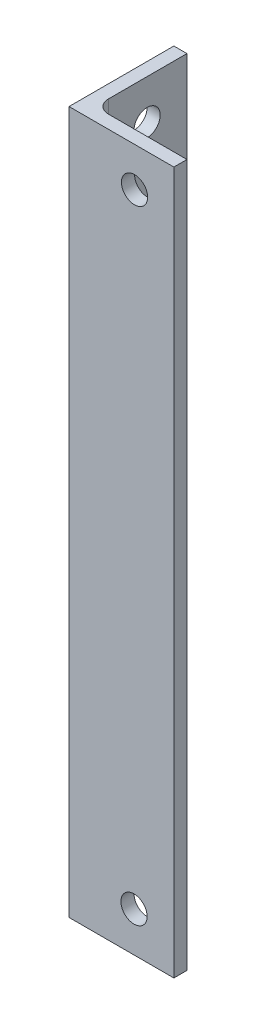
from build123d import *

# Parameters (mm, degrees)
BOSS_EXTRUDE1_DEPTH = 170.18
FILLET1_R           = 3.175
SKETCH2_R           = 3.175
CUT_EXTRUDE1_DEPTH  = 174.929734088
SKETCH3_R           = 3.175
CUT_EXTRUDE2_DEPTH  = 174.929734088
SKETCH4_R           = 3.175
CUT_EXTRUDE3_DEPTH  = 174.494504308
SKETCH5_R           = 3.175
CUT_EXTRUDE4_DEPTH  = 174.494504308


with BuildPart() as part:
    # Sketch1 → Boss-Extrude1 (new body)
    with BuildSketch(Plane(origin=(0, 0, 0), x_dir=(1, 0, 0), z_dir=(0, 1, 0))):
        Polygon((0, 0), (3.175, 0), (3.175, -22.225), (25.4, -22.225), (25.4, -25.4), (0, -25.4), align=None)
    extrude(amount=BOSS_EXTRUDE1_DEPTH)

    # Fillet1
    fillet1_edges = [part.edges().sort_by_distance(p)[0] for p in [
        (3.175, 85.09, 22.225),
    ]]
    fillet(fillet1_edges, radius=FILLET1_R)

    # Sketch2 → Cut-Extrude1 (cut, through all)
    with BuildSketch(Plane.ZY):
        with Locations((9.652, 160.528)):
            Circle(SKETCH2_R)
    extrude(amount=-CUT_EXTRUDE1_DEPTH, mode=Mode.SUBTRACT)

    # Sketch3 → Cut-Extrude2 (cut, through all)
    with BuildSketch(Plane.ZY):
        with Locations((9.652, 9.652)):
            Circle(SKETCH3_R)
    extrude(amount=-CUT_EXTRUDE2_DEPTH, mode=Mode.SUBTRACT)

    # Sketch4 → Cut-Extrude3 (cut, through all)
    with BuildSketch(Plane(origin=(0, 0, 22.225), x_dir=(-1, 0, 0), z_dir=(0, 0, -1))):
        with Locations((-15.748, 9.652)):
            Circle(SKETCH4_R)
    extrude(amount=-CUT_EXTRUDE3_DEPTH, mode=Mode.SUBTRACT)

    # Sketch5 → Cut-Extrude4 (cut, through all)
    with BuildSketch(Plane(origin=(0, 0, 22.225), x_dir=(-1, 0, 0), z_dir=(0, 0, -1))):
        with Locations((-15.875, 160.655)):
            Circle(SKETCH5_R)
    extrude(amount=-CUT_EXTRUDE4_DEPTH, mode=Mode.SUBTRACT)


solid = part.part
